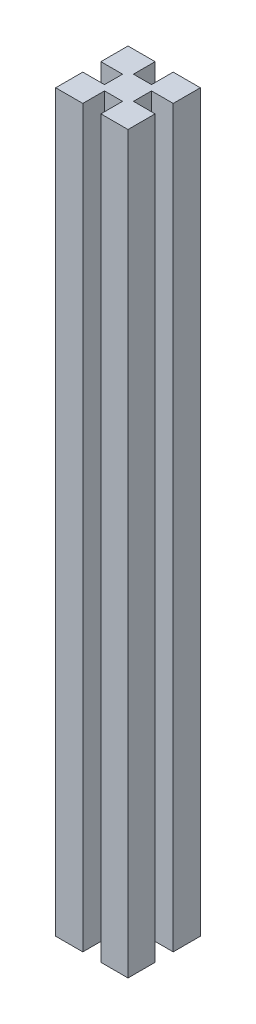
from build123d import *

# Parameters (mm, degrees)
BOSS_EXTRUDE1_DEPTH      = 101.6
BOSS_EXTRUDE1_DEPTH_BACK = 101.6
SKETCH1_W                = 20
SKETCH1_H                = 20
CUT_EXTRUDE1_DEPTH       = 103.579530122
CUT_EXTRUDE1_DEPTH_BACK  = 103.579530122
SKETCH2_W                = 5
SKETCH2_H                = 12
SKETCH2_W_2              = 12
SKETCH2_H_2              = 5


with BuildPart() as part:
    # Sketch1 → Boss-Extrude1 (new, two sides: drawn at the far end of the back side and taken through both)
    with BuildSketch(Plane(origin=(0, 0, 0), x_dir=(1, 0, 0), z_dir=(0, 1, 0)).offset(-BOSS_EXTRUDE1_DEPTH_BACK)):
        Rectangle(SKETCH1_W, SKETCH1_H)
    extrude(amount=BOSS_EXTRUDE1_DEPTH + BOSS_EXTRUDE1_DEPTH_BACK)

    # Sketch2 → Cut-Extrude1 (cut, two sides: drawn at the far end of the back side and taken through both)
    with BuildSketch(Plane(origin=(0, 0, 0), x_dir=(1, 0, 0), z_dir=(0, 1, 0)).offset(-CUT_EXTRUDE1_DEPTH_BACK)):
        with Locations((0, 10)):
            Rectangle(SKETCH2_W, SKETCH2_H)
        with Locations((10, 0)):
            Rectangle(SKETCH2_W_2, SKETCH2_H_2)
        with Locations((-10, 0)):
            Rectangle(SKETCH2_W_2, SKETCH2_H_2)
        with Locations((0, -10)):
            Rectangle(SKETCH2_W, SKETCH2_H)
    extrude(amount=CUT_EXTRUDE1_DEPTH + CUT_EXTRUDE1_DEPTH_BACK, mode=Mode.SUBTRACT)


solid = part.part
